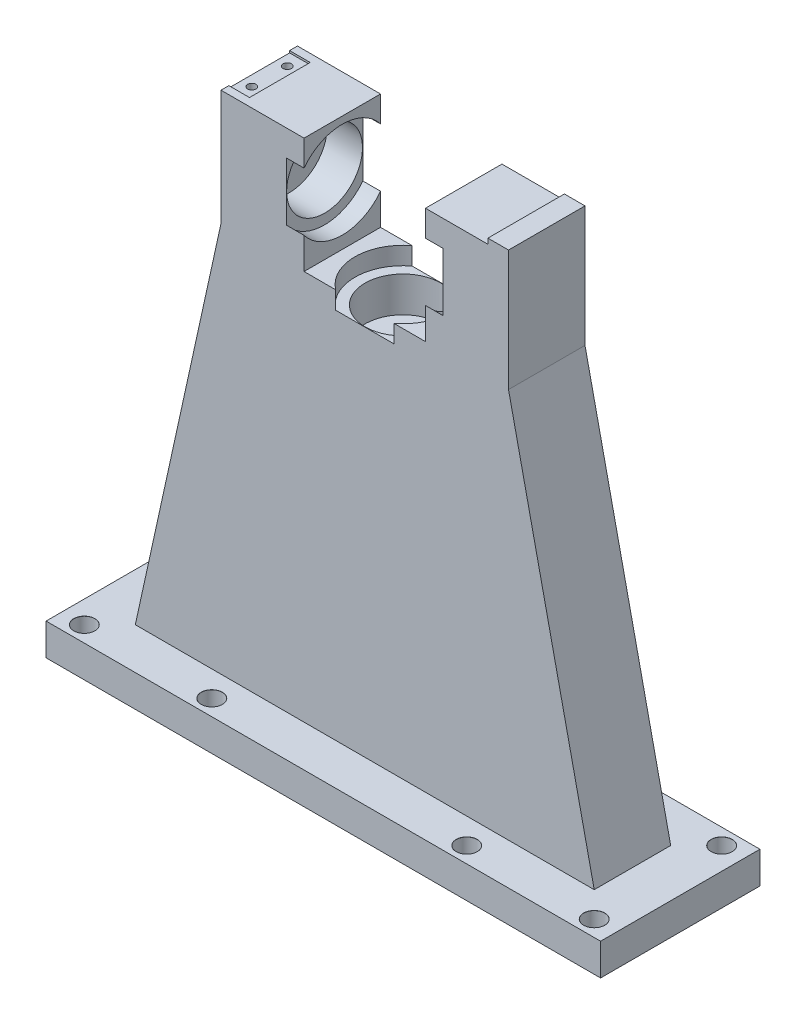
from build123d import *

# Parameters (mm, degrees)
SKETCH1_W                      = 174
SKETCH1_H                      = 50
BOSS_EXTRUDE1_DEPTH            = 10
M6_CLEARANCE_HOLE1_D           = 6.6
M6_CLEARANCE_HOLE1_CSINK_D     = 6.65
M6_CLEARANCE_HOLE1_CSINK_ANGLE = 100
BOSS_EXTRUDE2_DEPTH            = 12
BOSS_EXTRUDE2_DEPTH_BACK       = 12
CUT_EXTRUDE1_REACH             = 215.496
SKETCH7_W                      = 90.229970364
SKETCH7_H                      = 70
SKETCH8_R                      = 15.08125
CUT_EXTRUDE2_DEPTH             = 5.56
SKETCH9_R                      = 11.905
CUT_EXTRUDE3_DEPTH             = 11.1
SKETCH10_W                     = 26.063735182
SKETCH10_H                     = 24
BOSS_EXTRUDE3_DEPTH            = 36.25
CUT_EXTRUDE4_START             = -24.61125
SKETCH11_R                     = 15.08
CUT_EXTRUDE4_DEPTH             = 49.2225
CUT_EXTRUDE5_DEPTH             = 35.71125
CUT_EXTRUDE5_DEPTH_BACK        = 35.71125
SKETCH12_R                     = 11.905
SKETCH13_W                     = 6.477
SKETCH13_H                     = 19.05
CUT_EXTRUDE6_DEPTH             = 0.64
M2_CLEARANCE_HOLE1_D           = 2.6
M2_CLEARANCE_HOLE1_DEPTH       = 2
M2_CLEARANCE_HOLE1_TIP         = 0.781118805
SKETCH16_W                     = 6.477
SKETCH16_H                     = 24
BOSS_EXTRUDE4_DEPTH            = 1.67


with BuildPart() as part:
    # Sketch1 → Boss-Extrude1 (new body)
    with BuildSketch(Plane(origin=(0, 0, 0), x_dir=(1, 0, 0), z_dir=(0, 1, 0))):
        Rectangle(SKETCH1_W, SKETCH1_H)
    extrude(amount=BOSS_EXTRUDE1_DEPTH)

    # M6 Clearance Hole1 (through all)
    with Locations(Plane(origin=(0, 10, 0), x_dir=(1, 0, 0), z_dir=(0, 1, 0))):
        with Locations((-80, 20), (-40, 20), (-80, -20), (-40, -20), (40, 20), (80, 20), (40, -20), (80, -20)):
            CounterSinkHole(M6_CLEARANCE_HOLE1_D / 2, M6_CLEARANCE_HOLE1_CSINK_D / 2, counter_sink_angle=M6_CLEARANCE_HOLE1_CSINK_ANGLE)

    # Sketch6 → Boss-Extrude2 (add, two sides: drawn at the far end of the back side and taken through both)
    with BuildSketch(Plane.XY.offset(-BOSS_EXTRUDE2_DEPTH_BACK)):
        with BuildLine():
            Line((-72, 10), (72, 10))
            Line((72, 10), (39.069577731, 160))
            ThreePointArc((39.069577731, 160), (0, 191.422815383), (-39.069577731, 160))
            Line((-39.069577731, 160), (-72, 10))
        make_face()
    extrude(amount=BOSS_EXTRUDE2_DEPTH + BOSS_EXTRUDE2_DEPTH_BACK)

    # Sketch7 → Cut-Extrude1 (cut, up to next)
    with BuildSketch(Plane.XY.offset(12), mode=Mode.PRIVATE) as cut_extrude1_sk1:
        with Locations((0, 167.46281538)):
            Rectangle(SKETCH7_W, SKETCH7_H)
    cut_extrude1_tool1 = extrude(cut_extrude1_sk1.sketch, amount=-CUT_EXTRUDE1_REACH, mode=Mode.PRIVATE) & part.part
    add(cut_extrude1_tool1.solids().sort_by_distance((0, 167.462815, 12))[0], mode=Mode.SUBTRACT)

    # Sketch8 → Cut-Extrude2 (cut)
    with BuildSketch(Plane(origin=(0, 132.46281538, 0), x_dir=(1, 0, 0), z_dir=(0, 1, 0))):
        Circle(SKETCH8_R)
    extrude(amount=-CUT_EXTRUDE2_DEPTH, mode=Mode.SUBTRACT)

    # Sketch9 → Cut-Extrude3 (cut)
    with BuildSketch(Plane(origin=(0, 126.90281538, 0), x_dir=(1, 0, 0), z_dir=(0, 1, 0))):
        with Locations(Location((0, 0, 0), (0, 0, 270))):
            Circle(SKETCH9_R)
    extrude(amount=-CUT_EXTRUDE3_DEPTH, mode=Mode.SUBTRACT)

    # Sketch10 → Boss-Extrude3 (add)
    with BuildSketch(Plane(origin=(0, 132.46281538, 0), x_dir=(1, 0, 0), z_dir=(0, 1, 0))):
        with Locations((-32.083117591, 0)):
            Rectangle(SKETCH10_W, SKETCH10_H)
        with Locations((32.083117591, 0)):
            Rectangle(SKETCH10_W, SKETCH10_H)
    extrude(amount=BOSS_EXTRUDE3_DEPTH)

    # Sketch11 → Cut-Extrude4 (cut)
    with BuildSketch(Plane(origin=(0, 0, 0), x_dir=(0, 0, -1), z_dir=(1, 0, 0)).offset(CUT_EXTRUDE4_START)):
        with Locations((0, 151.42281538)):
            Circle(SKETCH11_R)
    extrude(amount=CUT_EXTRUDE4_DEPTH, mode=Mode.SUBTRACT)

    # Sketch12 → Cut-Extrude5 (cut, two sides: drawn at the far end of the back side and taken through both)
    with BuildSketch(Plane(origin=(0, 0, 0), x_dir=(0, 0, -1), z_dir=(1, 0, 0)).offset(-CUT_EXTRUDE5_DEPTH_BACK)):
        with Locations(Location((0, 151.42281538, 0), (0, 0, 180))):
            Circle(SKETCH12_R)
    extrude(amount=CUT_EXTRUDE5_DEPTH + CUT_EXTRUDE5_DEPTH_BACK, mode=Mode.SUBTRACT)

    # Sketch13 → Cut-Extrude6 (cut)
    with BuildSketch(Plane(origin=(0, 168.71281538, 0), x_dir=(1, 0, 0), z_dir=(0, 1, 0))):
        with Locations((-41.876485182, 0)):
            Rectangle(SKETCH13_W, SKETCH13_H)
    extrude(amount=-CUT_EXTRUDE6_DEPTH, mode=Mode.SUBTRACT)

    # M2 Clearance Hole1
    with Locations(Plane(origin=(0, 168.07281538, 0), x_dir=(1, 0, 0), z_dir=(0, 1, 0))):
        with Locations((-41.876485182, 5.565), (-41.876485182, -5.565)):
            Hole(M2_CLEARANCE_HOLE1_D / 2, depth=M2_CLEARANCE_HOLE1_DEPTH)
            with Locations((0, 0, -(M2_CLEARANCE_HOLE1_DEPTH + M2_CLEARANCE_HOLE1_TIP / 2))):  # 118° drill point
                Cone(0, M2_CLEARANCE_HOLE1_D / 2, M2_CLEARANCE_HOLE1_TIP, mode=Mode.SUBTRACT)

    # Sketch16 → Boss-Extrude4 (add)
    with BuildSketch(Plane(origin=(0, 168.71281538, 0), x_dir=(1, 0, 0), z_dir=(0, 1, 0))):
        with Locations((41.876485182, 0)):
            Rectangle(SKETCH16_W, SKETCH16_H)
    extrude(amount=BOSS_EXTRUDE4_DEPTH)


solid = part.part
